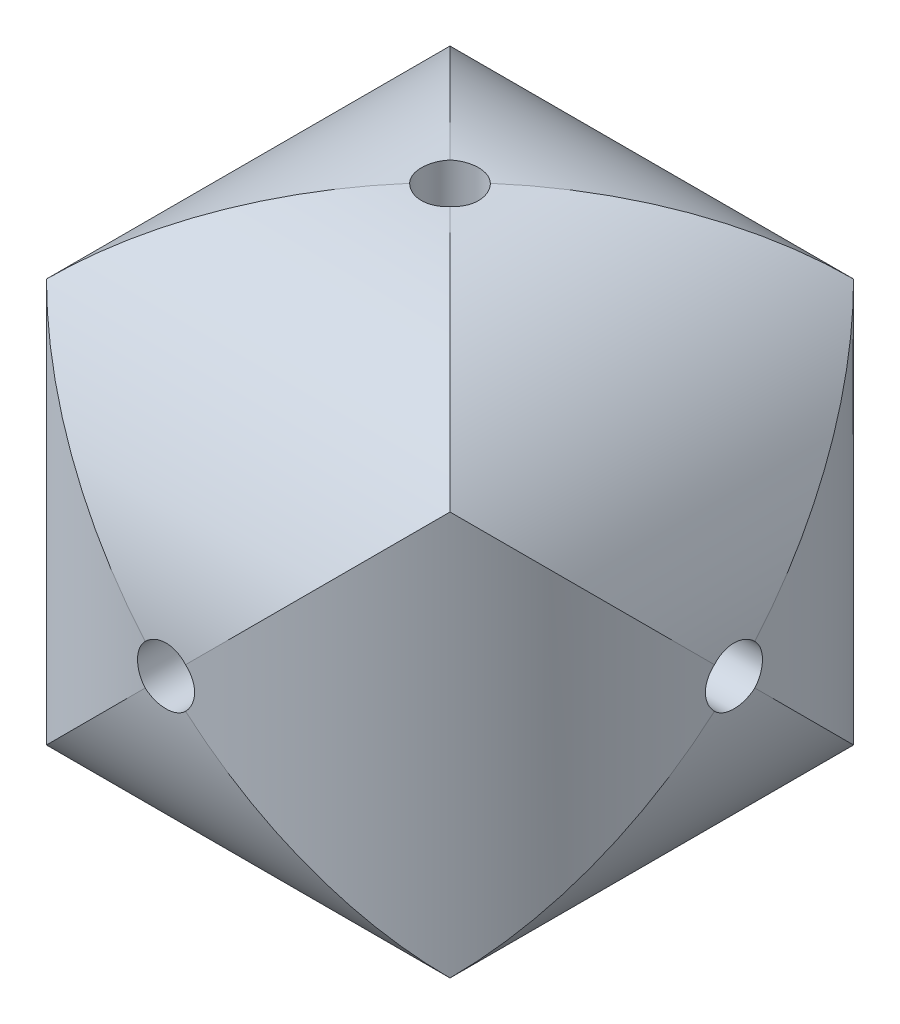
from build123d import *

# Parameters (mm, degrees)
SKETCH_2_W               = 20
SKETCH_2_H               = 20
EXTRUDE_1_DEPTH          = 10
SKETCH_3_OUTSIDE_W       = 28.928
SKETCH_3_OUTSIDE_H       = 28.928
SKETCH_3_OUTSIDE_R       = 5
CUT_EXTRUDE_1_DEPTH      = 20
SKETCH_4_OUTSIDE_W       = 16.898
SKETCH_4_OUTSIDE_H       = 26.898
SKETCH_4_OUTSIDE_R       = 5
CUT_EXTRUDE_2_DEPTH      = 10
SKETCH_5_OUTSIDE_W       = 15.464
SKETCH_5_OUTSIDE_H       = 15.464
SKETCH_5_OUTSIDE_R       = 5
CUT_EXTRUDE_3_DEPTH      = 10
CUT_EXTRUDE_4_REACH      = 10.66
SKETCH_6_R               = 0.5
PATTERN_CIRCULAR_1_COUNT = 4
CUT_EXTRUDE_5_DEPTH      = 9.645808409
CUT_EXTRUDE_5_DEPTH_BACK = 9.645808409
SKETCH_7_R               = 0.5


with BuildPart() as part:
    # 草图2 → 凸台-拉伸1 (new, symmetric)
    with BuildSketch(Plane(origin=(0, 0, 0), x_dir=(1, 0, 0), z_dir=(0, 1, 0))):
        Rectangle(SKETCH_2_W, SKETCH_2_H)
    extrude(amount=EXTRUDE_1_DEPTH, both=True)

    # 草图3 outside → 切除-拉伸1 (cut)
    with BuildSketch(Plane.XY.offset(10)):
        Rectangle(SKETCH_3_OUTSIDE_W, SKETCH_3_OUTSIDE_H)
        Circle(SKETCH_3_OUTSIDE_R, mode=Mode.SUBTRACT)
    extrude(amount=-CUT_EXTRUDE_1_DEPTH, mode=Mode.SUBTRACT)

    # 草图4 outside → 切除-拉伸2 (cut, symmetric)
    with BuildSketch(Plane(origin=(0, 0, 0), x_dir=(1, 0, 0), z_dir=(0, 1, 0))):
        Rectangle(SKETCH_4_OUTSIDE_W, SKETCH_4_OUTSIDE_H)
        Circle(SKETCH_4_OUTSIDE_R, mode=Mode.SUBTRACT)
    extrude(amount=CUT_EXTRUDE_2_DEPTH, both=True, mode=Mode.SUBTRACT)

    # 草图5 outside → 切除-拉伸3 (cut, symmetric)
    with BuildSketch(Plane(origin=(0, 0, 0), x_dir=(0, 0, -1), z_dir=(1, 0, 0))):
        Rectangle(SKETCH_5_OUTSIDE_W, SKETCH_5_OUTSIDE_H)
        Circle(SKETCH_5_OUTSIDE_R, mode=Mode.SUBTRACT)
    extrude(amount=CUT_EXTRUDE_3_DEPTH, both=True, mode=Mode.SUBTRACT)

    # 草图6 → 切除-拉伸4 (cut, up to next)
    with BuildSketch(Plane(origin=(0, 0, 0), x_dir=(0, 0, -1), z_dir=(1, 0, 0)), mode=Mode.PRIVATE) as cut_extrude_4_sk1:
        Circle(SKETCH_6_R)
    cut_extrude_4_tool1 = extrude(cut_extrude_4_sk1.sketch, amount=-CUT_EXTRUDE_4_REACH, mode=Mode.PRIVATE) & part.part
    cut_extrude_4 = cut_extrude_4_tool1.solids().sort_by_distance((0, 0, 0))[0]
    add(cut_extrude_4, mode=Mode.SUBTRACT)

    # 阵列(圆周)1: 切除-拉伸4 ×4 about axis
    pattern_circular_1_axis = Axis((0, 5.5, 0), (0, -1, 0))
    for i in range(1, PATTERN_CIRCULAR_1_COUNT):
        add(cut_extrude_4.rotate(pattern_circular_1_axis, i * 360 / PATTERN_CIRCULAR_1_COUNT), mode=Mode.SUBTRACT)

    # 草图7 → 切除-拉伸5 (cut, two sides: drawn at the far end of the back side and taken through both)
    with BuildSketch(Plane(origin=(0, 0, 0), x_dir=(1, 0, 0), z_dir=(0, 1, 0)).offset(-CUT_EXTRUDE_5_DEPTH_BACK)):
        with Locations(Location((0, 0, 0), (0, 0, 314.999999812))):
            Circle(SKETCH_7_R)
    extrude(amount=CUT_EXTRUDE_5_DEPTH + CUT_EXTRUDE_5_DEPTH_BACK, mode=Mode.SUBTRACT)


solid = part.part
